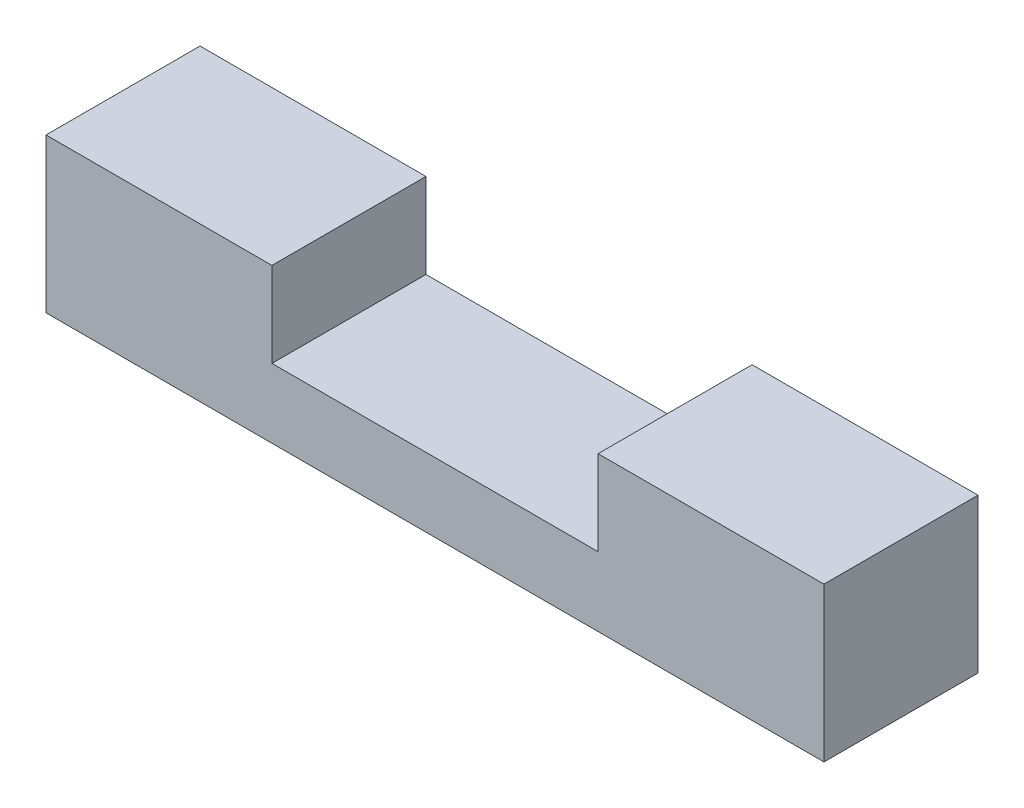
from build123d import *

# Parameters (mm, degrees)
SKETCH_1_W          = 99
SKETCH_1_H          = 19.6
EXTRUDE_1_DEPTH     = 19.6
SKETCH_3_W          = 41.5
SKETCH_3_H          = 19.6
CUT_EXTRUDE_1_DEPTH = 10.8
SKETCH_4_W          = 19.6
SKETCH_4_H          = 19.6
EXTRUDE_2_DEPTH     = 0.5
SHELL_1_T           = -2
SKETCH_6_W          = 15.6
SKETCH_6_H          = 15.6
EXTRUDE_3_DEPTH     = 2


with BuildPart() as part:
    # 草圖1 → 填料-伸長1 (new body)
    with BuildSketch(Plane.XY):
        Rectangle(SKETCH_1_W, SKETCH_1_H)
    extrude(amount=EXTRUDE_1_DEPTH)

    # 草圖3 → 除料-伸長1 (cut)
    with BuildSketch(Plane(origin=(0, 9.8, 0), x_dir=(1, 0, 0), z_dir=(0, 1, 0))):
        with Locations((0, -9.8)):
            Rectangle(SKETCH_3_W, SKETCH_3_H)
    extrude(amount=-CUT_EXTRUDE_1_DEPTH, mode=Mode.SUBTRACT)

    # 草圖4 → 填料-伸長2 (add)
    with BuildSketch(Plane(origin=(49.5, 0, 0), x_dir=(0, 0, -1), z_dir=(1, 0, 0))):
        with Locations((-9.8, 0)):
            Rectangle(SKETCH_4_W, SKETCH_4_H)
    extrude(amount=-EXTRUDE_2_DEPTH)

    # 薄殼1
    shell_1_openings = [part.faces().sort_by_distance(p)[0] for p in [
        (49.5, 0, 9.8),
    ]]
    offset(amount=SHELL_1_T, openings=shell_1_openings, kind=Kind.INTERSECTION)

    # 草圖6 → 填料-伸長3 (add)
    with BuildSketch(Plane(origin=(49.5, 0, 0), x_dir=(0, 0, -1), z_dir=(1, 0, 0))):
        with Locations((-9.8, 0)):
            Rectangle(SKETCH_6_W, SKETCH_6_H)
    extrude(amount=-EXTRUDE_3_DEPTH)


solid = part.part
